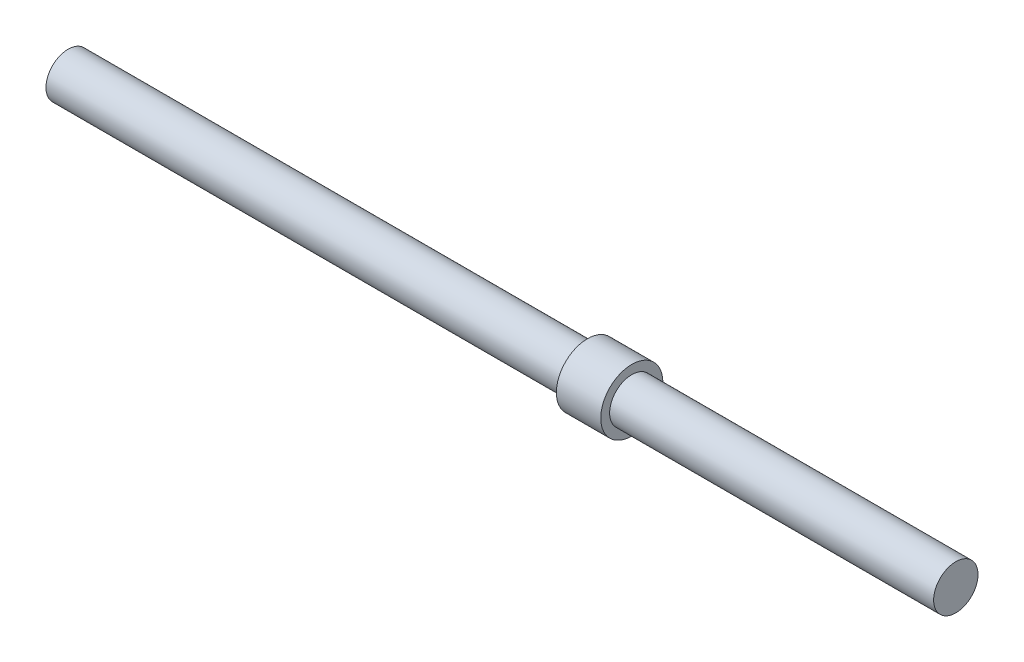
from build123d import *

# Parameters (mm, degrees)
SKETCH1_R           = 5
BOSS_EXTRUDE1_DEPTH = 100
BOSS_EXTRUDE3_START = 17
SKETCH3_R           = 7
BOSS_EXTRUDE3_DEPTH = 10


with BuildPart() as part:
    # Sketch1 → Boss-Extrude1 (new, symmetric)
    with BuildSketch(Plane(origin=(0, 0, 0), x_dir=(0, 0, -1), z_dir=(1, 0, 0))):
        Circle(SKETCH1_R)
    extrude(amount=BOSS_EXTRUDE1_DEPTH, both=True)

    # Sketch3 → Boss-Extrude3 (add)
    with BuildSketch(Plane(origin=(0, 0, 0), x_dir=(0, 0, -1), z_dir=(1, 0, 0)).offset(BOSS_EXTRUDE3_START)):
        Circle(SKETCH3_R)
    extrude(amount=BOSS_EXTRUDE3_DEPTH)


solid = part.part
